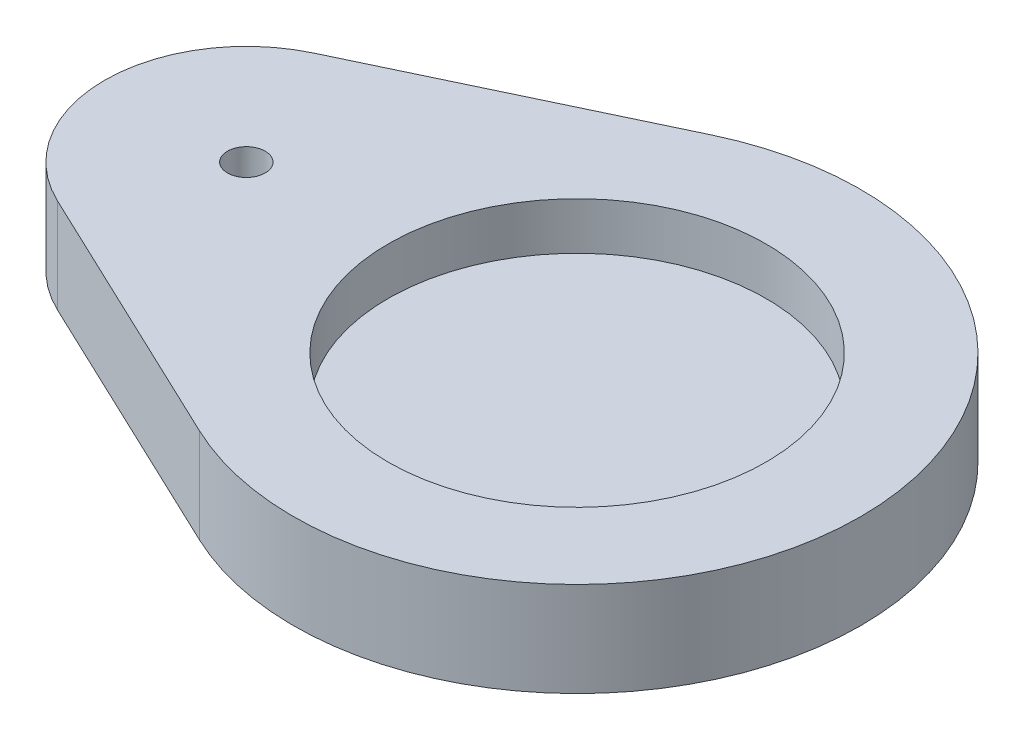
from build123d import *

# Parameters (mm, degrees)
SKETCH1_R           = 60
BOSS_EXTRUDE1_DEPTH = 20
SKETCH3_R           = 4
BOSS_EXTRUDE2_DEPTH = 20
SKETCH2_R           = 40
CUT_EXTRUDE1_DEPTH  = 10
SKETCH5_R           = 12
CUT_EXTRUDE2_DEPTH  = 5


with BuildPart() as part:
    # Sketch1 → Boss-Extrude1 (new body)
    with BuildSketch(Plane(origin=(0, 0, 0), x_dir=(1, 0, 0), z_dir=(0, 1, 0))):
        with Locations(Location((0, 0, 0), (0, 0, 270))):
            Circle(SKETCH1_R)
    extrude(amount=BOSS_EXTRUDE1_DEPTH)

    # Sketch3 → Boss-Extrude2 (add)
    with BuildSketch(Plane(origin=(0, 0, 0), x_dir=(1, 0, 0), z_dir=(0, 1, 0))):
        with BuildLine():
            Line((-82.857142857, 27.105237087), (-25.714285714, 54.210474174))
            ThreePointArc((-25.714285714, 54.210474174), (60, 0), (-25.714285714, -54.210474174))
            Line((-25.714285714, -54.210474174), (-82.857142857, -27.105237087))
            ThreePointArc((-82.857142857, -27.105237087), (-100, 0), (-82.857142857, 27.105237087))
        make_face()
        with Locations(Location((-70, 0, 0), (0, 0, 270))):
            Circle(SKETCH3_R, mode=Mode.SUBTRACT)
    extrude(amount=BOSS_EXTRUDE2_DEPTH)

    # Sketch2 → Cut-Extrude1 (cut)
    with BuildSketch(Plane(origin=(0, 20, 0), x_dir=(1, 0, 0), z_dir=(0, 1, 0))):
        with Locations(Location((0, 0, 0), (0, 0, 270))):
            Circle(SKETCH2_R)
    extrude(amount=-CUT_EXTRUDE1_DEPTH, mode=Mode.SUBTRACT)

    # Sketch5 → Cut-Extrude2 (cut)
    with BuildSketch(Plane.XZ):
        with Locations(Location((-70, 0, 0), (0, 0, 270))):
            Circle(SKETCH5_R)
    extrude(amount=-CUT_EXTRUDE2_DEPTH, mode=Mode.SUBTRACT)


solid = part.part
